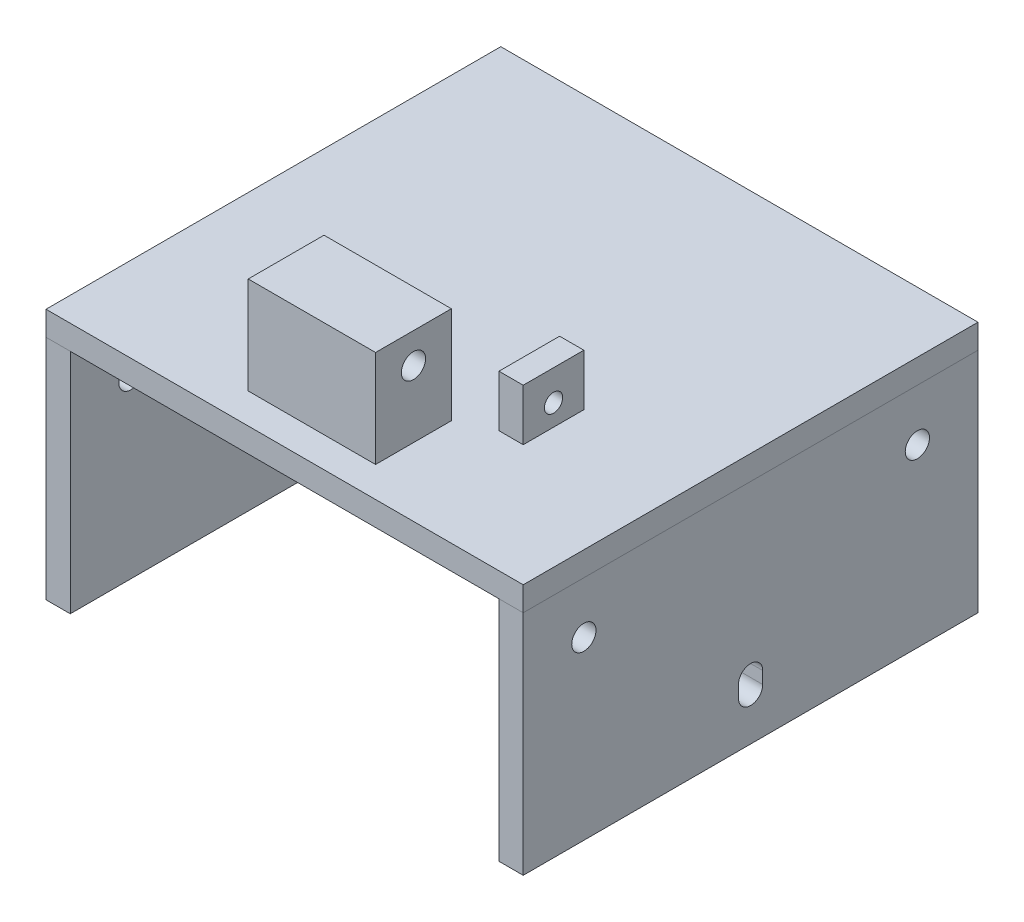
from build123d import *

# Parameters (mm, degrees)
SKETCH1_W             = 157.4
SKETCH1_H             = 8
BOSS_EXTRUDE1_DEPTH   = 150
SKETCH2_W             = 8
SKETCH2_H             = 150
BOSS_EXTRUDE2_DEPTH   = 75
BOSS_EXTRUDE2_2_DEPTH = 75
SKETCH3_R             = 4
CUT_EXTRUDE1_DEPTH    = 232.334735827
SKETCH5_W             = 42
SKETCH5_H             = 25
BOSS_EXTRUDE3_DEPTH   = 32
SKETCH7_R             = 4
CUT_EXTRUDE2_DEPTH    = 197.17005378
SKETCH8_W             = 8
SKETCH8_H             = 20
BOSS_EXTRUDE4_DEPTH   = 17
SKETCH9_R             = 3
CUT_EXTRUDE3_DEPTH    = 8


with BuildPart() as part:
    # Sketch1 → Boss-Extrude1 (new body)
    with BuildSketch(Plane.XY):
        Rectangle(SKETCH1_W, SKETCH1_H)
    extrude(amount=BOSS_EXTRUDE1_DEPTH)

    # Sketch8 → Boss-Extrude4 (add)
    with BuildSketch(Plane(origin=(0, 4, 0), x_dir=(1, 0, 0), z_dir=(0, 1, 0))):
        with Locations((34.7, -100)):
            Rectangle(SKETCH8_W, SKETCH8_H)
    extrude(amount=BOSS_EXTRUDE4_DEPTH)

    # Sketch9 → Cut-Extrude3 (cut)
    with BuildSketch(Plane(origin=(38.7, 0, 0), x_dir=(0, 0, -1), z_dir=(1, 0, 0))):
        with Locations((-100, 11)):
            Circle(SKETCH9_R)
    extrude(amount=-CUT_EXTRUDE3_DEPTH, mode=Mode.SUBTRACT)


with BuildPart() as body_2:
    # Sketch2 → Boss-Extrude2 (new body)
    with BuildSketch(Plane.XZ.offset(4)):
        with Locations((-74.7, 75)):
            Rectangle(SKETCH2_W, SKETCH2_H)
    extrude(amount=BOSS_EXTRUDE2_DEPTH)


with BuildPart() as body_3:
    # Sketch2 → Boss-Extrude2 2 (new body)
    with BuildSketch(Plane.XZ.offset(4)):
        with Locations((74.7, 75)):
            Rectangle(SKETCH2_W, SKETCH2_H)
    extrude(amount=BOSS_EXTRUDE2_2_DEPTH)


with BuildPart() as cut_extrude1_tool:
    # Sketch3 → Cut-Extrude1 (new, through all)
    with BuildSketch(Plane.ZY.offset(78.7)):
        with Locations((130, -21)):
            Circle(SKETCH3_R)
        with Locations((20, -21)):
            Circle(SKETCH3_R)
        with BuildLine():
            Line((79, -60), (79, -64))
            ThreePointArc((79, -64), (75, -68), (71, -64))
            Line((71, -64), (71, -60))
            ThreePointArc((71, -60), (75, -56), (79, -60))
        make_face()
    extrude(amount=-CUT_EXTRUDE1_DEPTH)


with BuildPart() as body_2_1:
    add(body_2.part)

    # Cut-Extrude1: cut by cut_extrude1_tool
    add(cut_extrude1_tool.part, mode=Mode.SUBTRACT)


with BuildPart() as body_3_1:
    add(body_3.part)

    # Cut-Extrude1: cut by cut_extrude1_tool
    add(cut_extrude1_tool.part, mode=Mode.SUBTRACT)


with BuildPart() as body_4:
    # Sketch5 → Boss-Extrude3 (new body)
    with BuildSketch(Plane(origin=(0, 4, 0), x_dir=(1, 0, 0), z_dir=(0, 1, 0))):
        with Locations((-1, -127.5)):
            Rectangle(SKETCH5_W, SKETCH5_H)
    extrude(amount=BOSS_EXTRUDE3_DEPTH)

    # Sketch7 → Cut-Extrude2 (cut, through all)
    with BuildSketch(Plane(origin=(20, 0, 0), x_dir=(0, 0, -1), z_dir=(1, 0, 0))):
        with Locations((-127.5, 26)):
            Circle(SKETCH7_R)
    extrude(amount=-CUT_EXTRUDE2_DEPTH, mode=Mode.SUBTRACT)


solid = Compound([part.part, body_2_1.part, body_3_1.part, body_4.part])
